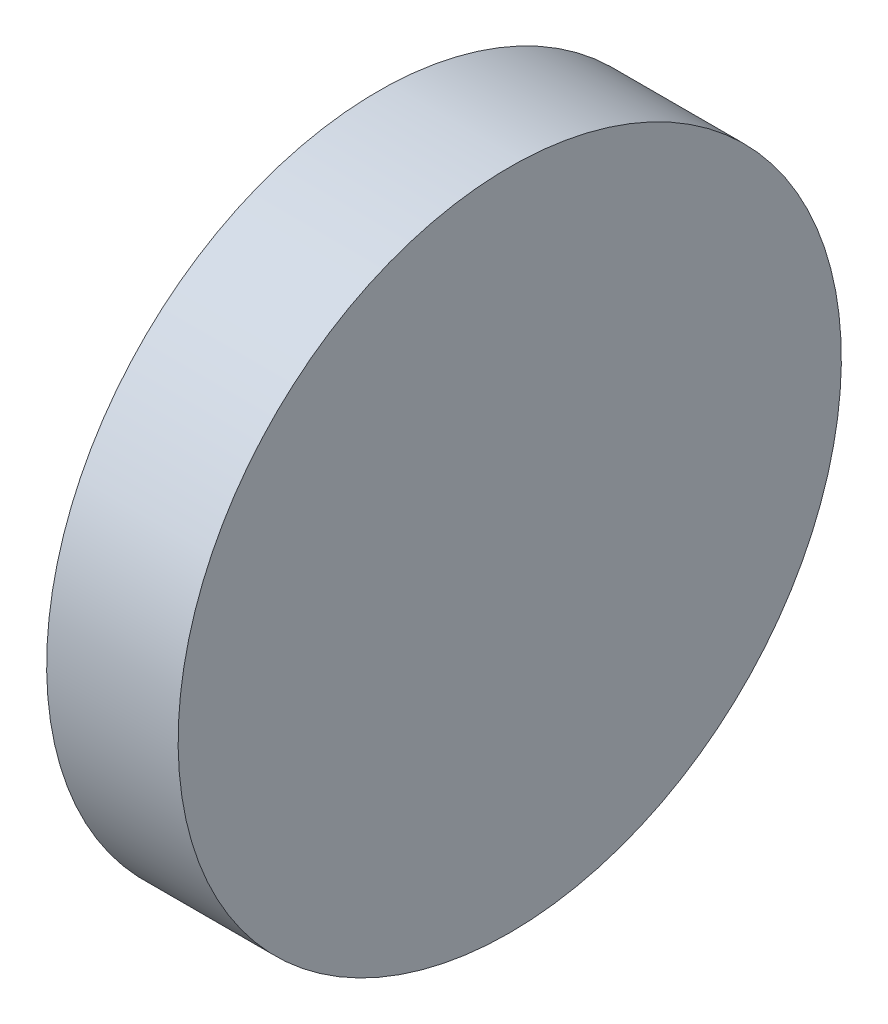
from build123d import *

# Parameters (mm, degrees)
SKETCH1_W = 1.57
SKETCH1_H = 3.96


with BuildPart() as part:
    # Sketch1 → Revolve1 (revolve)
    with BuildSketch(Plane.XY, mode=Mode.PRIVATE) as revolve1_sk:
        with Locations((0, 1.98)):
            Rectangle(SKETCH1_W, SKETCH1_H)
    revolve(revolve1_sk.sketch.rotate(Axis((-0.785, 0, 0), (1, 0, 0)), 180), axis=Axis((-0.785, 0, 0), (1, 0, 0)))


solid = part.part
